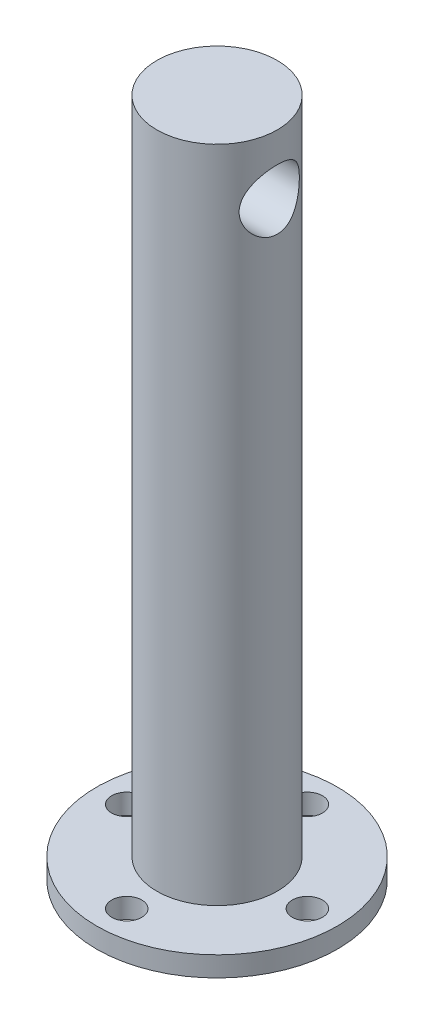
from build123d import *

# Parameters (mm, degrees)
SKETCH1_R           = 30
BOSS_EXTRUDE1_DEPTH = 5
SKETCH2_R           = 3.75
CUT_EXTRUDE1_DEPTH  = 5
SKETCH3_R           = 15
BOSS_EXTRUDE2_DEPTH = 164.27
SKETCH4_R           = 7.5
CUT_EXTRUDE2_DEPTH  = 178.700120709


with BuildPart() as part:
    # Sketch1 → Boss-Extrude1 (new body)
    with BuildSketch(Plane(origin=(0, 0, 0), x_dir=(1, 0, 0), z_dir=(0, 1, 0))):
        with Locations(Location((0, 0, 0), (0, 0, 270))):
            Circle(SKETCH1_R)
    extrude(amount=BOSS_EXTRUDE1_DEPTH)

    # Sketch2 → Cut-Extrude1 (cut)
    with BuildSketch(Plane(origin=(0, 5, 0), x_dir=(1, 0, 0), z_dir=(0, 1, 0))):
        with Locations(Location((0, 22.5, 0), (0, 0, 270))):
            Circle(SKETCH2_R)
        with Locations(Location((22.5, 0, 0), (0, 0, 270))):
            Circle(SKETCH2_R)
        with Locations(Location((0, -22.5, 0), (0, 0, 270))):
            Circle(SKETCH2_R)
        with Locations(Location((-22.5, 0, 0), (0, 0, 270))):
            Circle(SKETCH2_R)
    extrude(amount=-CUT_EXTRUDE1_DEPTH, mode=Mode.SUBTRACT)

    # Sketch3 → Boss-Extrude2 (add)
    with BuildSketch(Plane(origin=(0, 5, 0), x_dir=(1, 0, 0), z_dir=(0, 1, 0))):
        with Locations(Location((0, 0, 0), (0, 0, 270))):
            Circle(SKETCH3_R)
    extrude(amount=BOSS_EXTRUDE2_DEPTH)

    # Sketch4 → Cut-Extrude2 (cut, through all)
    with BuildSketch(Plane(origin=(15, 0, 0), x_dir=(0, 0, -1), z_dir=(1, 0, 0))):
        with Locations((0, 154.27)):
            Circle(SKETCH4_R)
    extrude(amount=-CUT_EXTRUDE2_DEPTH, mode=Mode.SUBTRACT)


solid = part.part
